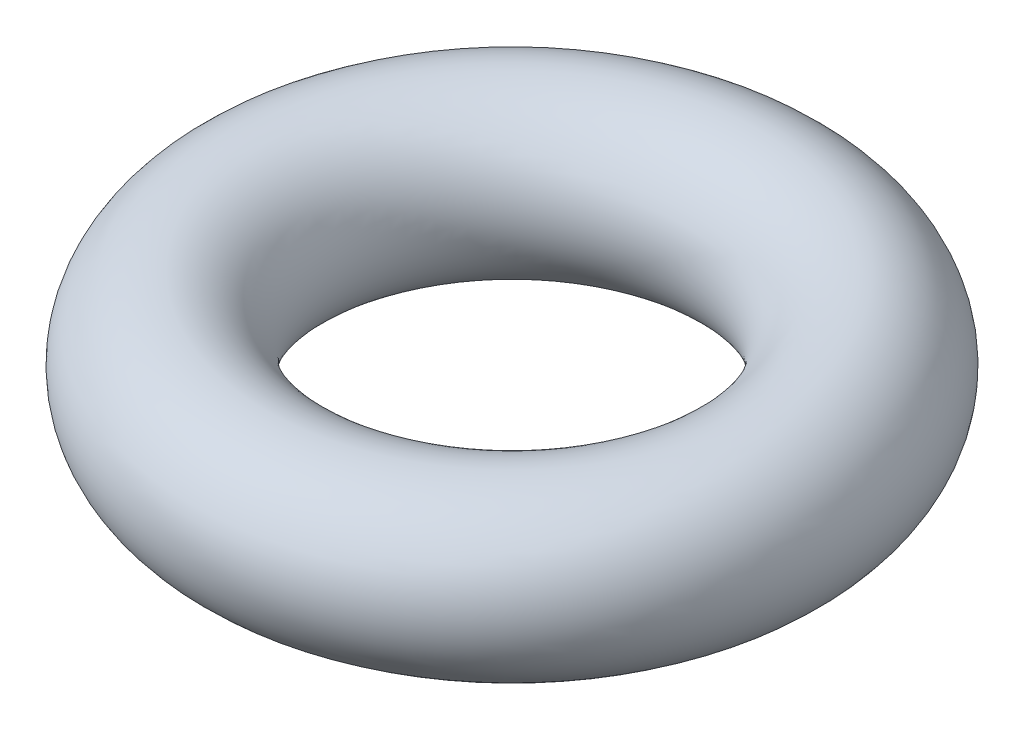
from build123d import *

# Parameters (mm, degrees)
SKETCH1_R = 0.79375


with BuildPart() as part:
    # Sketch1 → Revolve1 (revolve)
    with BuildSketch(Plane.XY, mode=Mode.PRIVATE) as revolve1_sk:
        with Locations((2.3876, 0)):
            Circle(SKETCH1_R)
    revolve(revolve1_sk.sketch.rotate(Axis((0, -24.564198097, 0), (0, 1, 0)), 90), axis=Axis((0, -24.564198097, 0), (0, 1, 0)))


solid = part.part
